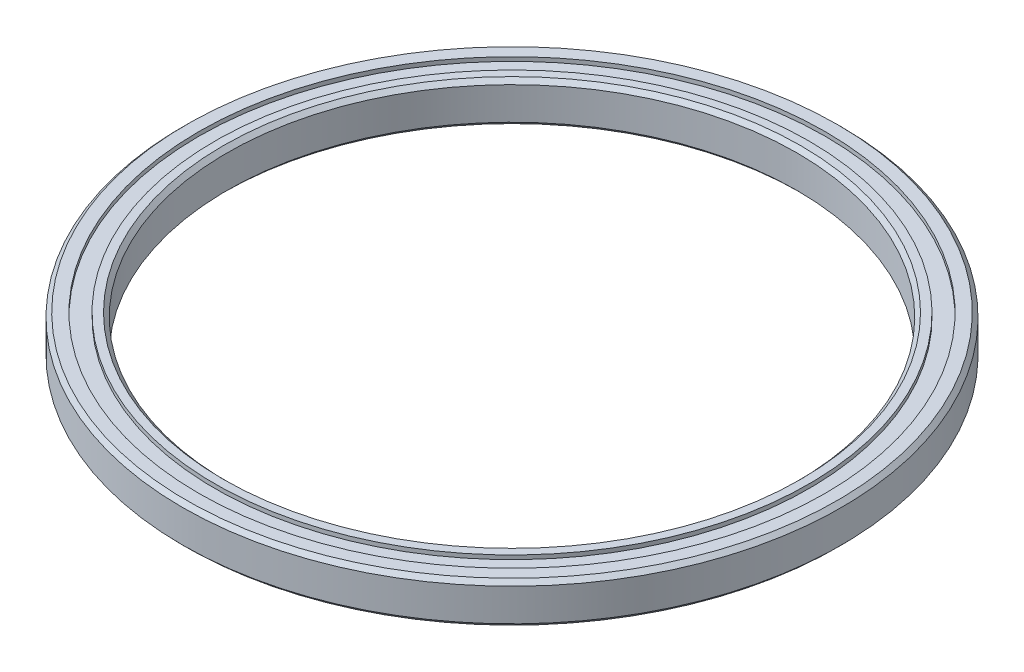
from build123d import *


with BuildPart() as part:
    # 草图1 → 旋转1 (revolve)
    with BuildSketch(Plane.XY, mode=Mode.PRIVATE) as revolve_1_sk:
        Polygon((-35.5, 0), (-36.5, 0), (-36.5, 0.5), (-38.5, 0.5), (-38.5, 0), (-40, 0), (-40.5, 0.5), (-40.5, 4.5), (-40, 5), (-38.5, 5), (-38.5, 4.5), (-36.5, 4.5), (-36.5, 5), (-35.5, 5), (-35, 4.5), (-35, 0.5), align=None)
    revolve(revolve_1_sk.sketch.rotate(Axis((0, 0, 0), (0, 1, 0)), 270), axis=Axis((0, 0, 0), (0, 1, 0)))


solid = part.part
